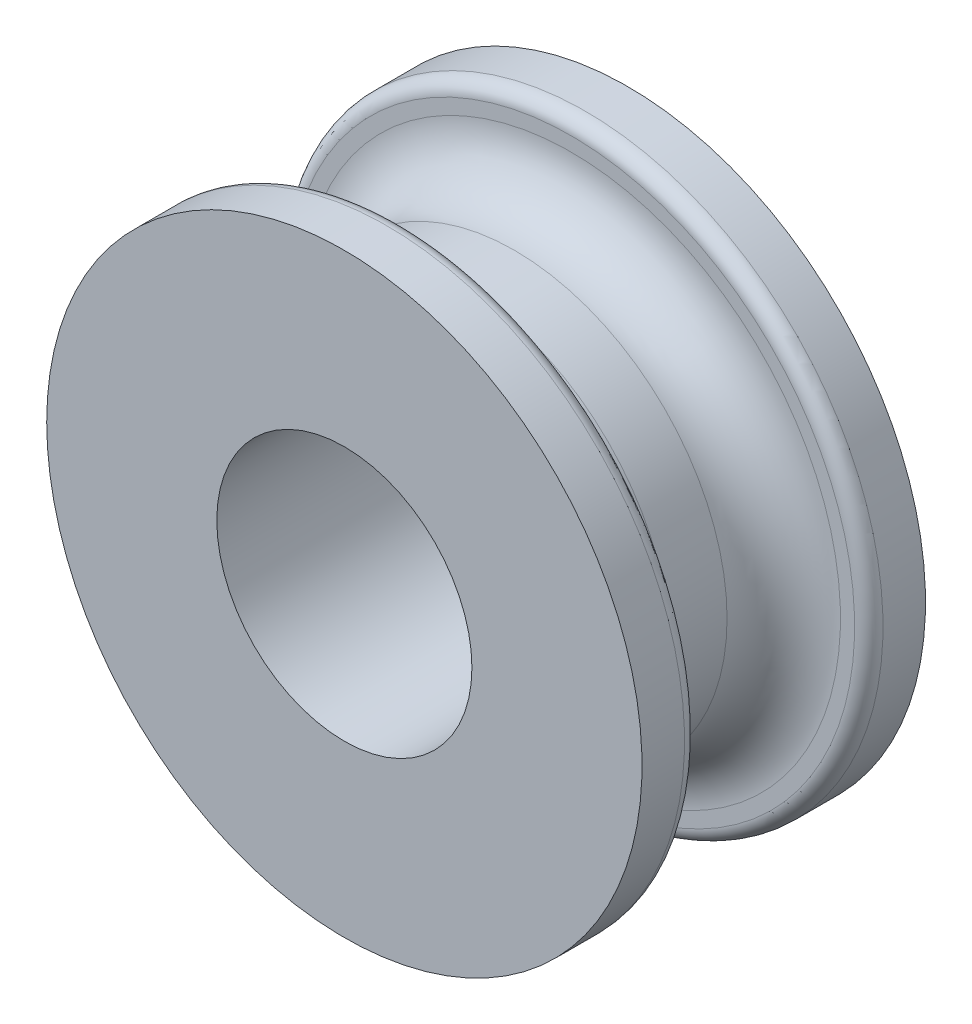
from build123d import *


with BuildPart() as part:
    # Sketch2 → Revolve1 (revolve)
    with BuildSketch(Plane(origin=(0, 0, 0), x_dir=(1, 0, 0), z_dir=(0, 1, 0)), mode=Mode.PRIVATE) as revolve1_sk:
        with BuildLine():
            Line((4.5, 0), (10.5, 0))
            Line((10.5, 0), (10.5, 1.5))
            ThreePointArc((10.5, 1.5), (10.353553391, 1.853553391), (10, 2))
            Line((10, 2), (9.5, 2))
            ThreePointArc((9.5, 2), (8.085786438, 2.585786438), (7.5, 4))
            Line((7.5, 4), (7.5, 6))
            ThreePointArc((7.5, 6), (8.085786438, 7.414213562), (9.5, 8))
            Line((9.5, 8), (10, 8))
            ThreePointArc((10, 8), (10.353553391, 8.146446609), (10.5, 8.5))
            Line((10.5, 8.5), (10.5, 10))
            Line((10.5, 10), (4.5, 10))
            Line((4.5, 10), (4.5, 0))
        make_face()
    revolve(revolve1_sk.sketch.rotate(Axis((0, 0, -10), (0, 0, 1)), 180), axis=Axis((0, 0, -10), (0, 0, 1)))


solid = part.part
